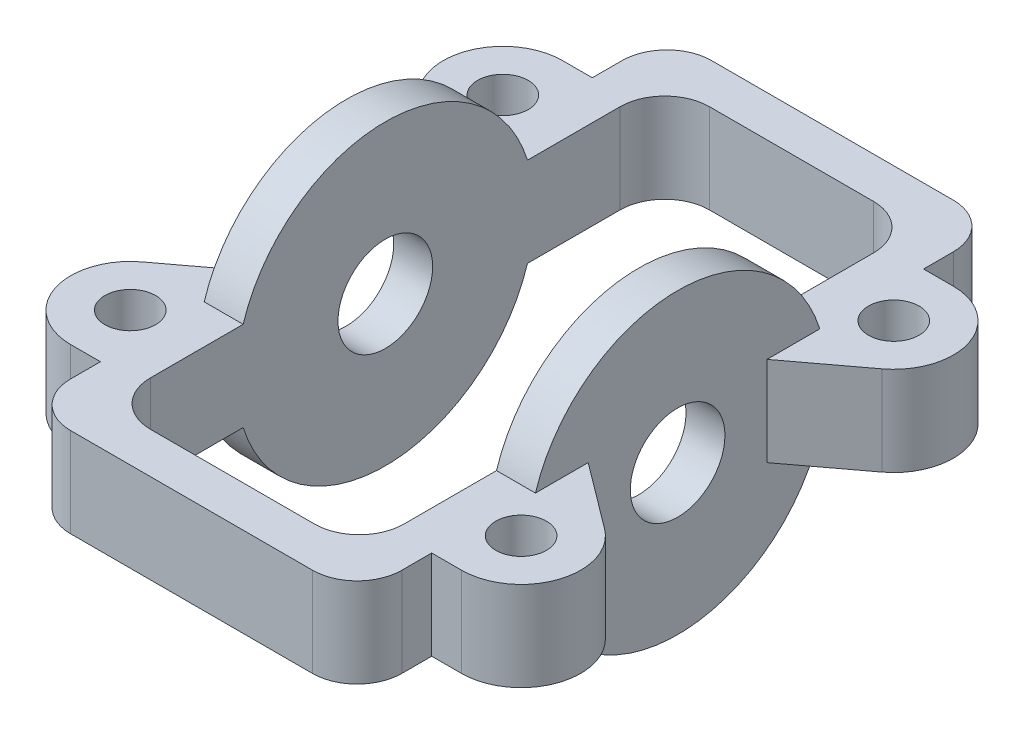
from build123d import *

# Parameters (mm, degrees)
SKETCH1_W               = 22.225
SKETCH1_H               = 43
BOSS_EXTRUDE1_DEPTH     = 6
SKETCH3_R               = 10
BOSS_EXTRUDE2_DEPTH     = 22.225
CUT_EXTRUDE1_DEPTH      = 28.47248908
CUT_EXTRUDE1_DEPTH_BACK = 28.47248908
SKETCH4_W               = 17
SKETCH4_H               = 37.5
CUT_EXTRUDE2_DEPTH      = 28.47248908
CUT_EXTRUDE2_DEPTH_BACK = 28.47248908
SKETCH5_R               = 3.175
BOSS_EXTRUDE3_DEPTH     = 6
M3_CLEARANCE_HOLE1_D    = 3.4
FILLET1_R               = 3
FILLET2_R               = 3
BOSS_EXTRUDE4_DEPTH     = 6


with BuildPart() as part:
    # Sketch1 → Boss-Extrude1 (new body)
    with BuildSketch(Plane(origin=(0, 0, 0), x_dir=(1, 0, 0), z_dir=(0, 1, 0))):
        Rectangle(SKETCH1_W, SKETCH1_H)
    extrude(amount=-BOSS_EXTRUDE1_DEPTH)

    # Sketch3 → Boss-Extrude2 (add)
    with BuildSketch(Plane(origin=(11.1125, 0, 0), x_dir=(0, 0, -1), z_dir=(1, 0, 0))):
        with Locations((0, -3)):
            Circle(SKETCH3_R)
    extrude(amount=-BOSS_EXTRUDE2_DEPTH)

    # Sketch4 → Cut-Extrude1 (cut, two sides: drawn at the far end of the back side and taken through both)
    with BuildSketch(Plane(origin=(0, 0, 0), x_dir=(1, 0, 0), z_dir=(0, 1, 0)).offset(-CUT_EXTRUDE1_DEPTH_BACK)):
        Rectangle(SKETCH4_W, SKETCH4_H)
    extrude(amount=CUT_EXTRUDE1_DEPTH + CUT_EXTRUDE1_DEPTH_BACK, mode=Mode.SUBTRACT)

    # Sketch5 → Cut-Extrude2 (cut, two sides: drawn at the far end of the back side and taken through both)
    with BuildSketch(Plane(origin=(0, 0, 0), x_dir=(0, 0, -1), z_dir=(1, 0, 0)).offset(-CUT_EXTRUDE2_DEPTH_BACK)):
        with Locations((0, -3)):
            Circle(SKETCH5_R)
    extrude(amount=CUT_EXTRUDE2_DEPTH + CUT_EXTRUDE2_DEPTH_BACK, mode=Mode.SUBTRACT)

    # Sketch7 → Boss-Extrude3 (add)
    with BuildSketch(Plane(origin=(0, 0, 0), x_dir=(1, 0, 0), z_dir=(0, 1, 0))):
        with BuildLine():
            Line((11.1125, 16.5), (13.1125, 16.5))
            ThreePointArc((13.1125, 16.5), (17.1125, 12.5), (13.1125, 8.5))
            Line((13.1125, 8.5), (11.1125, 8.5))
            Line((11.1125, 8.5), (11.1125, 16.5))
        make_face()
        with BuildLine():
            Line((11.1125, -16.5), (13.1125, -16.5))
            ThreePointArc((13.1125, -16.5), (17.1125, -12.5), (13.1125, -8.5))
            Line((13.1125, -8.5), (11.1125, -8.5))
            Line((11.1125, -8.5), (11.1125, -16.5))
        make_face()
        with BuildLine():
            Line((-11.1125, -8.5), (-11.1125, -16.5))
            Line((-11.1125, -16.5), (-13.1125, -16.5))
            ThreePointArc((-13.1125, -16.5), (-17.1125, -12.5), (-13.1125, -8.5))
            Line((-13.1125, -8.5), (-11.1125, -8.5))
        make_face()
        with BuildLine():
            Line((-11.1125, 8.5), (-11.1125, 16.5))
            Line((-11.1125, 16.5), (-13.1125, 16.5))
            ThreePointArc((-13.1125, 16.5), (-17.1125, 12.5), (-13.1125, 8.5))
            Line((-13.1125, 8.5), (-11.1125, 8.5))
        make_face()
    extrude(amount=-BOSS_EXTRUDE3_DEPTH)

    # M3 Clearance Hole1 (through all)
    with Locations(Plane(origin=(0, 0, 0), x_dir=(1, 0, 0), z_dir=(0, 1, 0))):
        with Locations((13.1125, 12.5), (-13.1125, 12.5), (-13.1125, -12.5), (13.1125, -12.5)):
            Hole(M3_CLEARANCE_HOLE1_D / 2)

    # Fillet1
    fillet1_edges = [part.edges().sort_by_distance(p)[0] for p in [
        (11.1125, -3, 21.5),
        (-11.1125, -3, 21.5),
        (-11.1125, -3, -21.5),
        (11.1125, -3, -21.5),
    ]]
    fillet(fillet1_edges, radius=FILLET1_R)

    # Fillet2
    fillet2_edges = [part.edges().sort_by_distance(p)[0] for p in [
        (-8.5, -3, -18.75),
        (8.5, -3, 18.75),
        (-8.5, -3, 18.75),
        (8.5, -3, -18.75),
    ]]
    fillet(fillet2_edges, radius=FILLET2_R)

    # Sketch11 → Boss-Extrude4 (add)
    with BuildSketch(Plane(origin=(0, 0, 0), x_dir=(1, 0, 0), z_dir=(0, 1, 0))):
        with BuildLine():
            Line((-15.5125, -9.3), (-11.1125, -6))
            Line((-11.1125, -6), (-11.1125, -8.5))
            Line((-11.1125, -8.5), (-13.1125, -8.5))
            ThreePointArc((-13.1125, -8.5), (-14.377411064, -8.705266808), (-15.5125, -9.3))
        make_face()
        with BuildLine():
            Line((-11.1125, 8.5), (-13.1125, 8.5))
            ThreePointArc((-13.1125, 8.5), (-14.377411064, 8.705266808), (-15.5125, 9.3))
            Line((-15.5125, 9.3), (-11.1125, 6))
            Line((-11.1125, 6), (-11.1125, 8.5))
        make_face()
        with BuildLine():
            Line((15.5125, 9.3), (11.1125, 6))
            Line((11.1125, 6), (11.1125, 8.5))
            Line((11.1125, 8.5), (13.1125, 8.5))
            ThreePointArc((13.1125, 8.5), (14.377411064, 8.705266808), (15.5125, 9.3))
        make_face()
        with BuildLine():
            Line((11.1125, -8.5), (13.1125, -8.5))
            ThreePointArc((13.1125, -8.5), (14.377411064, -8.705266808), (15.5125, -9.3))
            Line((15.5125, -9.3), (11.1125, -6))
            Line((11.1125, -6), (11.1125, -8.5))
        make_face()
    extrude(amount=-BOSS_EXTRUDE4_DEPTH)


solid = part.part
